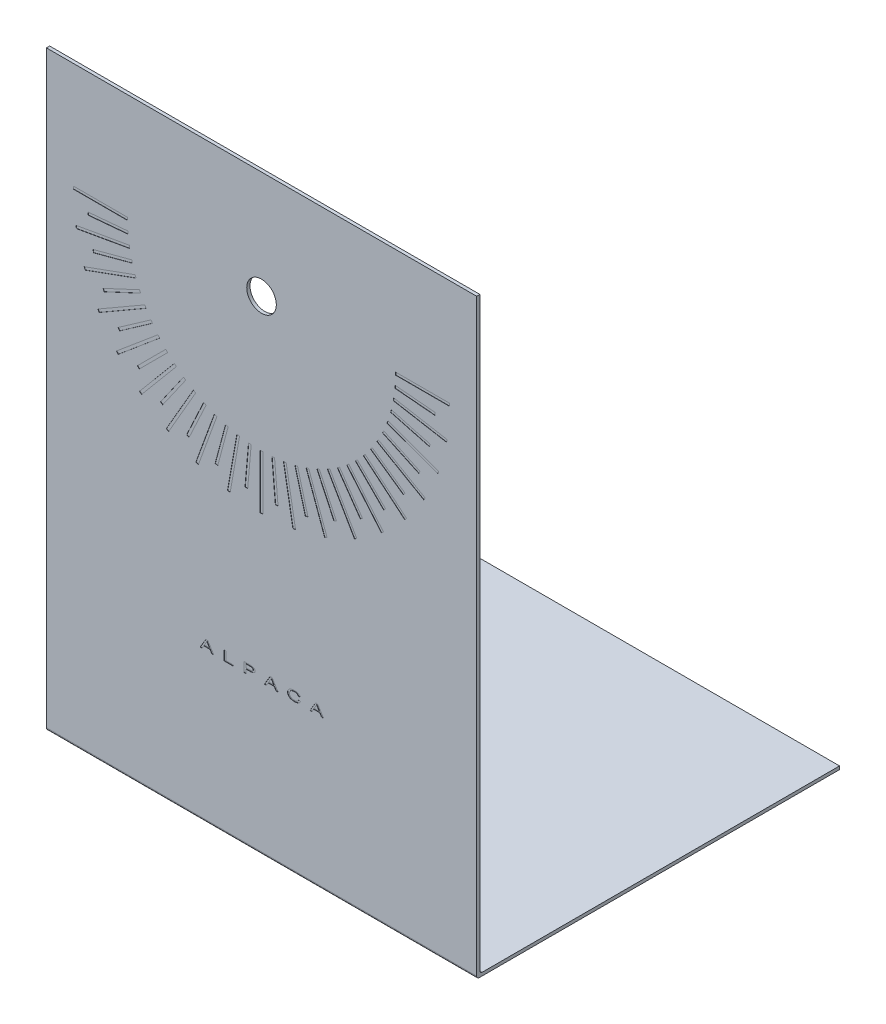
from build123d import *

# Parameters (mm, degrees)
BOSS_EXTRUDE1_DEPTH = 80
FILLET1_R           = 1
SKETCH2_R           = 5.5
CUT_EXTRUDE1_DEPTH  = 270.633899946
SKETCH3_W           = 20
SKETCH3_H           = 1
CUT_EXTRUDE2_DEPTH  = 0.1
CIRPATTERN1_COUNT   = 19
CIRPATTERN1_ANGLE   = 180
SKETCH5_W           = 14.921979321
SKETCH5_H           = 1
CUT_EXTRUDE3_DEPTH  = 0.1
CIRPATTERN2_COUNT   = 37
CIRPATTERN2_ANGLE   = 180
CUT_EXTRUDE4_DEPTH  = 0.1


with BuildPart() as part:
    # Sketch1 → Boss-Extrude1 (new, symmetric)
    with BuildSketch(Plane(origin=(0, 0, 0), x_dir=(0, 0, -1), z_dir=(1, 0, 0))):
        Polygon((0, 0), (0, 220), (1.2, 220), (1.2, 1.2), (135, 1.2), (135, 0), align=None)
    extrude(amount=BOSS_EXTRUDE1_DEPTH, both=True)

    # Fillet1
    fillet1_edges = [part.edges().sort_by_distance(p)[0] for p in [
        (0, 0, 0),
        (0, 1.2, -1.2),
    ]]
    fillet(fillet1_edges, radius=FILLET1_R)

    # Sketch2 → Cut-Extrude1 (cut, through all)
    with BuildSketch(Plane(origin=(0, 0, -1.2), x_dir=(-1, 0, 0), z_dir=(0, 0, -1))):
        with Locations((0, 180)):
            Circle(SKETCH2_R)
    extrude(amount=-CUT_EXTRUDE1_DEPTH, mode=Mode.SUBTRACT)

    # Sketch3 → Cut-Extrude2 (cut)
    with BuildSketch(Plane.XY):
        with Locations((-60, 180)):
            Rectangle(SKETCH3_W, SKETCH3_H)
    cut_extrude2 = extrude(amount=-CUT_EXTRUDE2_DEPTH, mode=Mode.SUBTRACT)

    # CirPattern1: Cut-Extrude2 ×19 about axis
    cirpattern1_axis = Axis((0, 180, 0), (0, 0, 1))
    for i in range(1, CIRPATTERN1_COUNT):
        add(cut_extrude2.rotate(cirpattern1_axis, i * CIRPATTERN1_ANGLE / (CIRPATTERN1_COUNT - 1)), mode=Mode.SUBTRACT)

    # Sketch5 → Cut-Extrude3 (cut)
    with BuildSketch(Plane.XY):
        with Locations((-57.325774673, 180)):
            Rectangle(SKETCH5_W, SKETCH5_H)
    cut_extrude3 = extrude(amount=-CUT_EXTRUDE3_DEPTH, mode=Mode.SUBTRACT)

    # CirPattern2: Cut-Extrude3 ×37 about axis
    cirpattern2_axis = Axis((0, 180, 0), (0, 0, 1))
    for i in range(1, CIRPATTERN2_COUNT):
        add(cut_extrude3.rotate(cirpattern2_axis, i * CIRPATTERN2_ANGLE / (CIRPATTERN2_COUNT - 1)), mode=Mode.SUBTRACT)

    # Sketch6 → Cut-Extrude4 (cut)
    # profile 1 of 6: a face of its own
    with BuildSketch(Plane.XY):
        Polygon((-22.8281693, 55.579353969), (-20.721298307, 59.079353969), (-19.968293499, 59.079353969), (-17.75765648, 55.579353969), (-18.522580358, 55.579353969), (-19.154992217, 56.656277046), (-21.466590775, 56.656277046), (-22.067452153, 55.579353969), align=None)
        with BuildLine():
            Line((-21.241530678, 57.0601232), (-19.391971383, 57.0601232))
            Line((-19.391971383, 57.0601232), (-19.9297318, 57.977190507))
            add(Edge.make_bspline(
                [(-19.9297318, 57.977190507), (-19.950783157, 58.012937323), (-19.991767483, 58.082531847), (-20.051170922, 58.184073505), (-20.107528789, 58.279873268), (-20.160618096, 58.369691457), (-20.209970289, 58.454406618), (-20.255750106, 58.533457896), (-20.29966245, 58.606071278), (-20.326867644, 58.65303228), (-20.33988805, 58.675507815)],
                knots=[0, 0, 0, 0, 1.229386729, 2.39346032, 3.486248523, 4.523203634, 5.485369321, 6.391699624, 7.23026745, 8, 8, 8, 8], degree=3))
            add(Edge.make_bspline(
                [(-20.33988805, 58.675507815), (-20.361399826, 58.622259337), (-20.405085119, 58.51412436), (-20.480068722, 58.353476687), (-20.561314725, 58.190094776), (-20.620439527, 58.081934177), (-20.650485005, 58.026970155)],
                knots=[0, 0, 0, 0, 0.957559516, 1.944575326, 2.955493874, 4, 4, 4, 4], degree=3))
            Line((-20.650485005, 58.026970155), (-21.241530678, 57.0601232))
        make_face(mode=Mode.SUBTRACT)
    # profile 2 of 6: a face of its own
    with BuildSketch(Plane.XY):
        Polygon((-13.945657281, 55.579353969), (-13.945657281, 59.079353969), (-13.227708563, 59.079353969), (-13.227708563, 55.983200123), (-10.490529076, 55.983200123), (-10.490529076, 55.579353969), align=None)
    # profile 3 of 6: a face of its own
    with BuildSketch(Plane.XY):
        with BuildLine():
            Line((-6.541811127, 55.579353969), (-6.541811127, 59.079353969))
            Line((-6.541811127, 59.079353969), (-4.479811928, 59.079353969))
            add(Edge.make_bspline(
                [(-4.479811928, 59.079353969), (-4.43564125, 59.079156136), (-4.35010232, 59.078773021), (-4.225990979, 59.077631535), (-4.110074131, 59.074641132), (-4.002098541, 59.071156866), (-3.902040321, 59.067209838), (-3.809936991, 59.06163448), (-3.726031434, 59.054669729), (-3.672812081, 59.049060585), (-3.647580358, 59.046401245)],
                knots=[0, 0, 0, 0, 1.272222361, 2.463728079, 3.574709163, 4.611866503, 5.575280886, 6.458716203, 7.269264957, 8, 8, 8, 8], degree=3))
            add(Edge.make_bspline(
                [(-3.647580358, 59.046401245), (-3.583182755, 59.038615388), (-3.458887338, 59.023587713), (-3.28163444, 58.988020146), (-3.120468498, 58.942560921), (-2.974855228, 58.887387627), (-2.843596338, 58.821186129), (-2.725884765, 58.743324207), (-2.622994633, 58.65167508), (-2.547638868, 58.566831325), (-2.495238153, 58.494255944), (-2.461275684, 58.438043599), (-2.433642939, 58.380165353), (-2.409012172, 58.321806151), (-2.391034942, 58.261583482), (-2.378378901, 58.199866668), (-2.370503437, 58.137015108), (-2.369324852, 58.094533742), (-2.368734204, 58.073244193)],
                knots=[0, 0, 0, 0, 1.762174514, 3.401216925, 4.90686476, 6.308007487, 7.625847015, 8.894029392, 10.131304895, 11.359616412, 11.969414327, 12.561902814, 13.141313512, 13.710931242, 14.281504025, 14.845714995, 15.421529762, 16, 16, 16, 16], degree=3))
            add(Edge.make_bspline(
                [(-2.368734204, 58.073244193), (-2.370028692, 58.036910189), (-2.372589896, 57.96502165), (-2.394677642, 57.859688639), (-2.429023719, 57.758421628), (-2.477967035, 57.661333484), (-2.541978711, 57.569386383), (-2.618760739, 57.481327255), (-2.709908077, 57.398211006), (-2.7954437, 57.332960206), (-2.87211553, 57.283886792), (-2.936095132, 57.248562083), (-3.006291304, 57.216946677), (-3.081399602, 57.186385048), (-3.162359257, 57.159448795), (-3.248749389, 57.133857903), (-3.341106083, 57.111968423), (-3.438816626, 57.091553122), (-3.541882272, 57.073208891), (-3.650681816, 57.058079235), (-3.764996737, 57.044794477), (-3.885125531, 57.033434943), (-4.01091288, 57.02514999), (-4.142301706, 57.019774556), (-4.279037575, 57.016158061), (-4.372070499, 57.015557619), (-4.419515454, 57.015251405)],
                knots=[0, 0, 0, 0, 1.018453688, 2.015058579, 3.006234462, 4.012050573, 5.054206957, 6.14168712, 7.283214318, 8.50939774, 9.155124395, 9.835951986, 10.557702757, 11.313840276, 12.110081648, 12.950431858, 13.841030993, 14.772084048, 15.750929086, 16.777456188, 17.853489709, 18.979640505, 20.162527044, 21.389814482, 22.66885692, 24, 24, 24, 24], degree=3))
            Line((-4.419515454, 57.015251405), (-5.823862409, 57.015251405))
            Line((-5.823862409, 57.015251405), (-5.823862409, 55.579353969))
            Line((-5.823862409, 55.579353969), (-6.541811127, 55.579353969))
        make_face()
        with BuildLine():
            Line((-5.823862409, 57.419097559), (-4.392872826, 57.419097559))
            add(Edge.make_bspline(
                [(-4.392872826, 57.419097559), (-4.335840264, 57.419663143), (-4.226160463, 57.420750823), (-4.068027513, 57.428231668), (-3.92276737, 57.441464189), (-3.790073516, 57.459473575), (-3.670007711, 57.482017711), (-3.562795274, 57.510587253), (-3.468526102, 57.544517295), (-3.386601103, 57.584198513), (-3.315837981, 57.628477896), (-3.25493335, 57.677450271), (-3.202187773, 57.72986922), (-3.159984006, 57.787779606), (-3.127148718, 57.84965733), (-3.103839729, 57.915786591), (-3.089557203, 57.986163842), (-3.08765099, 58.034615599), (-3.086682922, 58.059221757)],
                knots=[0, 0, 0, 0, 1.690378523, 3.25078124, 4.690666625, 6.012170938, 7.218517235, 8.309028741, 9.297337578, 10.18335184, 11.002039886, 11.765785974, 12.49560779, 13.199424848, 13.881112776, 14.564663387, 15.271066265, 16, 16, 16, 16], degree=3))
            add(Edge.make_bspline(
                [(-3.086682922, 58.059221757), (-3.087199636, 58.077254401), (-3.088225358, 58.113050757), (-3.097060012, 58.165385849), (-3.110113943, 58.216178321), (-3.130197931, 58.264326351), (-3.154641019, 58.311104801), (-3.185380527, 58.355465029), (-3.22086776, 58.398380871), (-3.277147642, 58.451716853), (-3.356576757, 58.513149854), (-3.467094657, 58.570731939), (-3.590215448, 58.617660115), (-3.678774189, 58.635438159), (-3.724703755, 58.644658456)],
                knots=[0, 0, 0, 0, 0.687889983, 1.365521077, 2.021243969, 2.685589215, 3.352087548, 4.032590345, 4.741956235, 5.473854282, 6.988794528, 8.557425036, 10.214563881, 12, 12, 12, 12], degree=3))
            add(Edge.make_bspline(
                [(-3.724703755, 58.644658456), (-3.741749595, 58.647115418), (-3.779029782, 58.652488927), (-3.840094589, 58.658438898), (-3.910895118, 58.664240761), (-3.991578834, 58.668011084), (-4.08177972, 58.671773748), (-4.181830585, 58.673529509), (-4.291673231, 58.675013794), (-4.368332878, 58.675338525), (-4.408297505, 58.675507815)],
                knots=[0, 0, 0, 0, 0.603476985, 1.319837284, 2.149650349, 3.09281807, 4.150162496, 5.313447248, 6.599431586, 8, 8, 8, 8], degree=3))
            Line((-4.408297505, 58.675507815), (-5.823862409, 58.675507815))
            Line((-5.823862409, 58.675507815), (-5.823862409, 57.419097559))
        make_face(mode=Mode.SUBTRACT)
    # profile 4 of 6: a face of its own
    with BuildSketch(Plane.XY):
        Polygon((1.088497367, 55.579353969), (3.19536836, 59.079353969), (3.948373168, 59.079353969), (6.159010187, 55.579353969), (5.394086309, 55.579353969), (4.76167445, 56.656277046), (2.450075892, 56.656277046), (1.849214514, 55.579353969), align=None)
        with BuildLine():
            Line((2.675135988, 57.0601232), (4.524695283, 57.0601232))
            Line((4.524695283, 57.0601232), (3.986934867, 57.977190507))
            add(Edge.make_bspline(
                [(3.986934867, 57.977190507), (3.96588351, 58.012937323), (3.924899184, 58.082531847), (3.865495744, 58.184073505), (3.809137878, 58.279873268), (3.756048571, 58.369691457), (3.706696378, 58.454406618), (3.660916561, 58.533457896), (3.617004217, 58.606071278), (3.589799022, 58.65303228), (3.576778617, 58.675507815)],
                knots=[0, 0, 0, 0, 1.229386729, 2.39346032, 3.486248523, 4.523203634, 5.485369321, 6.391699624, 7.23026745, 8, 8, 8, 8], degree=3))
            add(Edge.make_bspline(
                [(3.576778617, 58.675507815), (3.555266841, 58.622259337), (3.511581548, 58.51412436), (3.436597945, 58.353476687), (3.355351941, 58.190094776), (3.29622714, 58.081934177), (3.266181661, 58.026970155)],
                knots=[0, 0, 0, 0, 0.957559516, 1.944575326, 2.955493874, 4, 4, 4, 4], degree=3))
            Line((3.266181661, 58.026970155), (2.675135988, 57.0601232))
        make_face(mode=Mode.SUBTRACT)
    # profile 5 of 6: a face of its own
    with BuildSketch(Plane.XY):
        with BuildLine():
            Line((13.829983745, 56.814730572), (14.547932463, 56.699746597))
            add(Edge.make_bspline(
                [(14.547932463, 56.699746597), (14.528101207, 56.653232635), (14.488789362, 56.561027196), (14.412996283, 56.431613655), (14.327494296, 56.30984369), (14.230472631, 56.196221724), (14.120728112, 56.092418328), (14.000841018, 55.995869387), (13.868653188, 55.909052631), (13.726514239, 55.829857154), (13.574338227, 55.759921825), (13.413219596, 55.699729225), (13.244071624, 55.648745551), (13.066916888, 55.606443403), (12.881389743, 55.574559013), (12.687617945, 55.551619976), (12.485679892, 55.537335112), (12.348303434, 55.535444293), (12.278401213, 55.534482174)],
                knots=[0, 0, 0, 0, 0.893611766, 1.771422196, 2.646512752, 3.52308615, 4.409006102, 5.314773826, 6.242306378, 7.202722369, 8.190427263, 9.201624545, 10.242574532, 11.313416028, 12.421185771, 13.57024494, 14.763650777, 16, 16, 16, 16], degree=3))
            add(Edge.make_bspline(
                [(12.278401213, 55.534482174), (12.206172943, 55.535130208), (12.065375663, 55.536393443), (11.859068635, 55.546949683), (11.66327306, 55.564910021), (11.47761489, 55.590405036), (11.302353887, 55.621159191), (11.137325014, 55.660620785), (10.982863633, 55.707380136), (10.838024061, 55.760710636), (10.703071335, 55.821309033), (10.576152086, 55.887927447), (10.457949351, 55.961444644), (10.347567597, 56.041026935), (10.246076239, 56.127321575), (10.152088823, 56.21965232), (10.066366068, 56.318330401), (9.990351856, 56.423765915), (9.922468958, 56.532740453), (9.863561707, 56.644326378), (9.813200972, 56.757796473), (9.772746757, 56.873460627), (9.740798165, 56.991055176), (9.718781821, 57.11067458), (9.703774036, 57.232217611), (9.702446221, 57.31411753), (9.701778617, 57.355295475)],
                knots=[0, 0, 0, 0, 1.466082407, 2.857889504, 4.191918903, 5.455920899, 6.66097643, 7.802414441, 8.897955972, 9.935153672, 10.933195536, 11.898744523, 12.842618178, 13.75643526, 14.658465777, 15.54407972, 16.428612986, 17.308247591, 18.179708218, 19.03279442, 19.86754659, 20.697255386, 21.517758622, 22.338398992, 23.164574088, 24, 24, 24, 24], degree=3))
            add(Edge.make_bspline(
                [(9.701778617, 57.355295475), (9.702634115, 57.399749226), (9.704327899, 57.487762319), (9.720444524, 57.617375283), (9.745089378, 57.742822324), (9.781803829, 57.863216451), (9.825857553, 57.98024196), (9.882826911, 58.091913063), (9.948875031, 58.199574637), (10.024768861, 58.302842877), (10.110252252, 58.400741877), (10.204517959, 58.49285078), (10.3075133, 58.578761126), (10.418992538, 58.658383928), (10.538734517, 58.732521655), (10.66762515, 58.799635801), (10.804820172, 58.861182289), (10.949845879, 58.916289169), (11.10090061, 58.964966614), (11.256389179, 59.007888459), (11.415818944, 59.043420811), (11.578839529, 59.072914183), (11.745583217, 59.096191543), (11.916149251, 59.111947932), (12.090376771, 59.122132952), (12.207807257, 59.123522946), (12.267183264, 59.124225764)],
                knots=[0, 0, 0, 0, 0.918356418, 1.818235533, 2.695414979, 3.557327701, 4.416665074, 5.276396026, 6.143745885, 7.024813222, 7.921770875, 8.826923521, 9.745927532, 10.690928096, 11.656057582, 12.65422292, 13.691980757, 14.762167674, 15.858905265, 16.970948163, 18.094730327, 19.233546552, 20.394126825, 21.573105858, 22.772897145, 24, 24, 24, 24], degree=3))
            add(Edge.make_bspline(
                [(12.267183264, 59.124225764), (12.333809318, 59.12344619), (12.464380524, 59.12191841), (12.656257037, 59.109108393), (12.84009137, 59.087937343), (13.016112834, 59.060056384), (13.18348735, 59.021519816), (13.343282697, 58.976579046), (13.494601863, 58.921591235), (13.637913934, 58.859498078), (13.771438361, 58.789607603), (13.89536946, 58.713044655), (14.007839343, 58.628639293), (14.111540145, 58.539131288), (14.202533199, 58.440729816), (14.284610308, 58.337013229), (14.355364588, 58.225481), (14.393939828, 58.146547962), (14.413317078, 58.106898039)],
                knots=[0, 0, 0, 0, 1.274061716, 2.496857662, 3.675492349, 4.812179902, 5.902933689, 6.958261541, 7.984668168, 8.979418827, 9.94299736, 10.864453151, 11.761913008, 12.629713835, 13.480322109, 14.320759785, 15.156478139, 16, 16, 16, 16], degree=3))
            Line((14.413317078, 58.106898039), (13.69536836, 58.001028648))
            add(Edge.make_bspline(
                [(13.69536836, 58.001028648), (13.678950952, 58.03141151), (13.646474729, 58.091513604), (13.591198313, 58.176536891), (13.529786403, 58.254512882), (13.463737397, 58.326561253), (13.391925501, 58.392007688), (13.31459211, 58.450886838), (13.232153258, 58.503812678), (13.144188701, 58.550247241), (13.05031688, 58.589878463), (12.951213877, 58.625356967), (12.846057686, 58.654182151), (12.735486436, 58.679121237), (12.618863709, 58.697824678), (12.496467902, 58.710963103), (12.368244242, 58.718679976), (12.280982541, 58.719804323), (12.236333905, 58.72037961)],
                knots=[0, 0, 0, 0, 0.961937428, 1.902864021, 2.821169316, 3.724344988, 4.62312081, 5.524322736, 6.429233617, 7.349637213, 8.291824619, 9.265937847, 10.280201577, 11.327574842, 12.422659737, 13.568838759, 14.756063301, 16, 16, 16, 16], degree=3))
            add(Edge.make_bspline(
                [(12.236333905, 58.72037961), (12.184902024, 58.719939448), (12.084290225, 58.719078398), (11.93671512, 58.709467825), (11.795560163, 58.695266021), (11.660844968, 58.673985691), (11.53220172, 58.647769693), (11.410117829, 58.614558598), (11.29416797, 58.576477302), (11.185470401, 58.531379974), (11.084063382, 58.481584053), (10.989390923, 58.428573912), (10.903308797, 58.370374501), (10.824834973, 58.308218042), (10.753717721, 58.242600649), (10.691175507, 58.172272164), (10.63652005, 58.097833125), (10.589893567, 58.019601047), (10.550654198, 57.93877263), (10.514868402, 57.857943719), (10.485691814, 57.776075095), (10.461683398, 57.693405292), (10.442713501, 57.610329116), (10.429318217, 57.52649054), (10.421523314, 57.442149889), (10.420326924, 57.385693048), (10.419727334, 57.357398841)],
                knots=[0, 0, 0, 0, 1.443760355, 2.824305187, 4.150337659, 5.425424176, 6.651785938, 7.834397428, 8.975601594, 10.075914074, 11.135260131, 12.146066172, 13.119686409, 14.049124016, 14.954439428, 15.832818093, 16.687169911, 17.543509914, 18.385680734, 19.20848396, 20.024140009, 20.823589002, 21.624248772, 22.414952662, 23.205629326, 24, 24, 24, 24], degree=3))
            add(Edge.make_bspline(
                [(10.419727334, 57.357398841), (10.420506647, 57.321390951), (10.422042435, 57.250430326), (10.431028429, 57.145683861), (10.446991062, 57.04440137), (10.470663897, 56.946714533), (10.49891127, 56.852080072), (10.534283732, 56.760874084), (10.576282949, 56.673468667), (10.624693037, 56.589540734), (10.68022589, 56.510400338), (10.742146564, 56.435403388), (10.811758965, 56.36579351), (10.889079453, 56.302164848), (10.973318311, 56.243835547), (11.063815446, 56.18942511), (11.162225979, 56.141267452), (11.267225664, 56.098984959), (11.376469491, 56.06168627), (11.488458392, 56.028498826), (11.602780954, 56.000180834), (11.719737521, 55.978435614), (11.838629984, 55.959571123), (11.959867144, 55.94715061), (12.08340886, 55.940281606), (12.166447245, 55.938982784), (12.208289033, 55.938328328)],
                knots=[0, 0, 0, 0, 1.002239951, 1.975110819, 2.923649182, 3.852923016, 4.77065149, 5.670572763, 6.572466521, 7.4672248, 8.364061279, 9.260189823, 10.170883663, 11.099497073, 12.043228151, 13.020438339, 14.035680775, 15.088968036, 16.16891196, 17.247385704, 18.339097295, 19.445132078, 20.557346726, 21.688721341, 22.835381606, 24, 24, 24, 24], degree=3))
            add(Edge.make_bspline(
                [(12.208289033, 55.938328328), (12.258791572, 55.93895076), (12.357806285, 55.940171093), (12.503072103, 55.951228682), (12.642694199, 55.967455823), (12.776043393, 55.992173121), (12.903934786, 56.023005173), (13.025829135, 56.060640381), (13.141832479, 56.10554893), (13.251421633, 56.157308398), (13.353713965, 56.21605642), (13.448086079, 56.28113095), (13.533611983, 56.353375884), (13.611133553, 56.431799978), (13.679379818, 56.517715608), (13.738390394, 56.610573288), (13.790332887, 56.709217199), (13.816690588, 56.779356664), (13.829983745, 56.814730572)],
                knots=[0, 0, 0, 0, 1.228504814, 2.4085928, 3.54266101, 4.646770185, 5.705908674, 6.741822186, 7.748115523, 8.729868764, 9.687617886, 10.61506343, 11.514907596, 12.40751891, 13.293750777, 14.178595281, 15.081398731, 16, 16, 16, 16], degree=3))
        make_face()
    # profile 6 of 6: a face of its own
    with BuildSketch(Plane.XY):
        Polygon((18.005164033, 55.579353969), (20.112035027, 59.079353969), (20.865039834, 59.079353969), (23.075676854, 55.579353969), (22.310752975, 55.579353969), (21.678341117, 56.656277046), (19.366742559, 56.656277046), (18.765881181, 55.579353969), align=None)
        with BuildLine():
            Line((19.591802655, 57.0601232), (21.44136195, 57.0601232))
            Line((21.44136195, 57.0601232), (20.903601533, 57.977190507))
            add(Edge.make_bspline(
                [(20.903601533, 57.977190507), (20.882550177, 58.012937323), (20.84156585, 58.082531847), (20.782162411, 58.184073505), (20.725804545, 58.279873268), (20.672715238, 58.369691457), (20.623363044, 58.454406618), (20.577583227, 58.533457896), (20.533670884, 58.606071278), (20.506465689, 58.65303228), (20.493445283, 58.675507815)],
                knots=[0, 0, 0, 0, 1.229386729, 2.39346032, 3.486248523, 4.523203634, 5.485369321, 6.391699624, 7.23026745, 8, 8, 8, 8], degree=3))
            add(Edge.make_bspline(
                [(20.493445283, 58.675507815), (20.471933508, 58.622259337), (20.428248215, 58.51412436), (20.353264612, 58.353476687), (20.272018608, 58.190094776), (20.212893806, 58.081934177), (20.182848328, 58.026970155)],
                knots=[0, 0, 0, 0, 0.957559516, 1.944575326, 2.955493874, 4, 4, 4, 4], degree=3))
            Line((20.182848328, 58.026970155), (19.591802655, 57.0601232))
        make_face(mode=Mode.SUBTRACT)
    extrude(amount=-CUT_EXTRUDE4_DEPTH, mode=Mode.SUBTRACT)


solid = part.part
